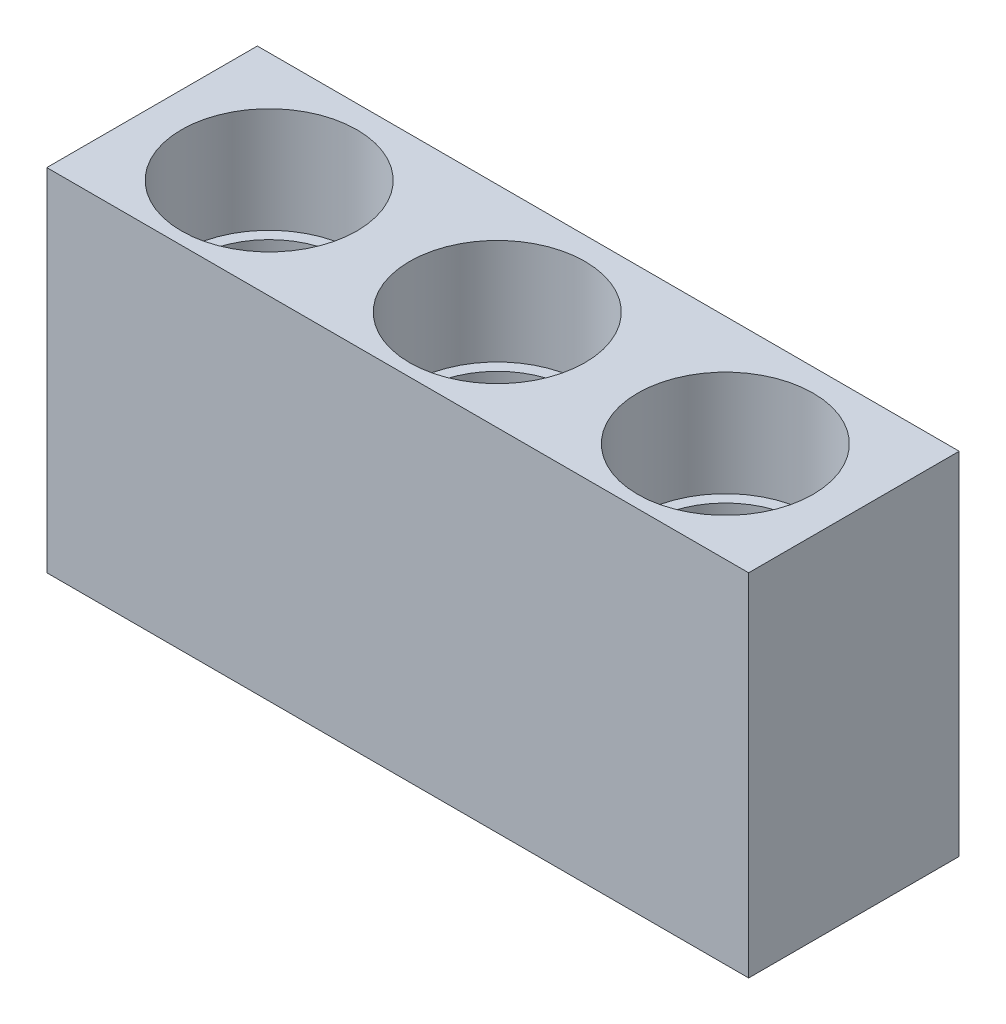
from build123d import *

# Parameters (mm, degrees)
SKETCH1_W           = 20
SKETCH1_H           = 6
BOSS_EXTRUDE1_DEPTH = 5
CUT_EXTRUDE1_START  = 5
SKETCH1_4_R         = 2.5
SKETCH1_4_R_2       = 2.175
CUT_EXTRUDE1_DEPTH  = 3
CUT_EXTRUDE2_START  = 2
SKETCH1_5_R         = 2.175
CUT_EXTRUDE2_DEPTH  = 5
LPATTERN1_COUNT     = 3
LPATTERN1_PITCH     = 6.5


with BuildPart() as part:
    # Sketch1 → Boss-Extrude1 (new, symmetric)
    with BuildSketch(Plane(origin=(0, 0, 0), x_dir=(1, 0, 0), z_dir=(0, 1, 0))):
        with Locations((0, 3)):
            Rectangle(SKETCH1_W, SKETCH1_H)
    extrude(amount=BOSS_EXTRUDE1_DEPTH, both=True)

    # Sketch1<4> → Cut-Extrude1 (cut)
    # profile 1 of 2: a face of its own
    with BuildSketch(Plane(origin=(0, 0, 0), x_dir=(1, 0, 0), z_dir=(0, 1, 0)).offset(CUT_EXTRUDE1_START)):
        with Locations(Location((-6.516339464, 2.853050679, 0), (0, 0, 270))):
            Circle(SKETCH1_4_R)
        with Locations((-6.516339464, 2.853050679)):
            Circle(SKETCH1_4_R_2, mode=Mode.SUBTRACT)
    # profile 2 of 2: a face of its own
    with BuildSketch(Plane(origin=(0, 0, 0), x_dir=(1, 0, 0), z_dir=(0, 1, 0)).offset(CUT_EXTRUDE1_START)):
        with Locations((-6.516339464, 2.853050679)):
            Circle(SKETCH1_4_R_2)
    cut_extrude1 = extrude(amount=-CUT_EXTRUDE1_DEPTH, mode=Mode.SUBTRACT)

    # Sketch1<5> → Cut-Extrude2 (cut)
    with BuildSketch(Plane(origin=(0, 0, 0), x_dir=(1, 0, 0), z_dir=(0, 1, 0)).offset(CUT_EXTRUDE2_START)):
        with Locations(Location((-6.516339464, 2.853050679, 0), (0, 0, 270))):
            Circle(SKETCH1_5_R)
    cut_extrude2 = extrude(amount=-CUT_EXTRUDE2_DEPTH, mode=Mode.SUBTRACT)

    # LPattern1: Cut-Extrude1, Cut-Extrude2 ×3
    with Locations(*[(i * LPATTERN1_PITCH, 0, 0) for i in range(1, LPATTERN1_COUNT)]):
        add(cut_extrude1, mode=Mode.SUBTRACT)
        add(cut_extrude2, mode=Mode.SUBTRACT)


solid = part.part
